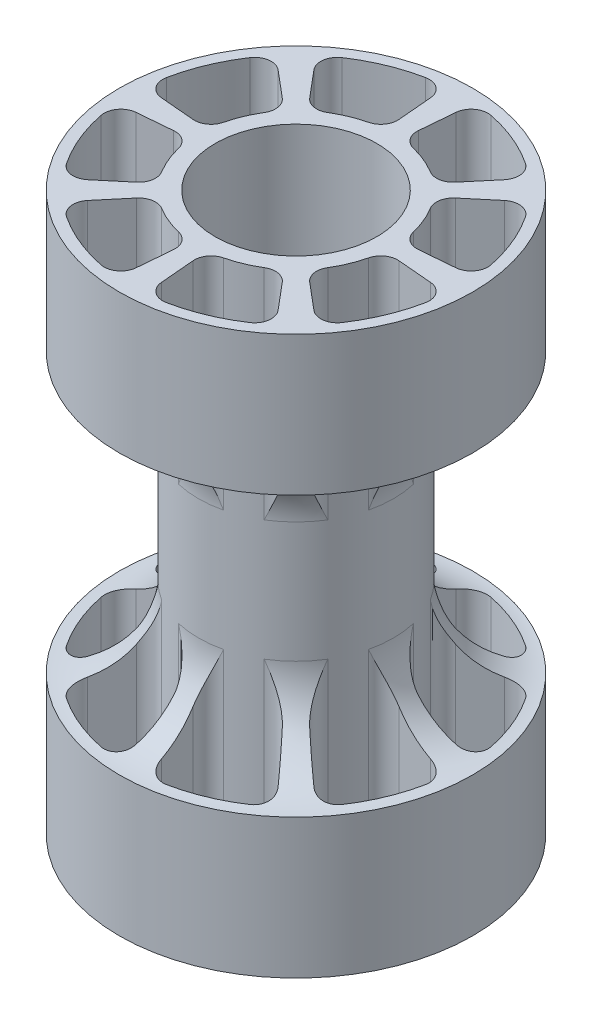
from build123d import *
from build123d.topology import SkipClean

# Parameters (mm, degrees)
SKETCH1_R           = 17.5
SKETCH1_R_2         = 14.5
BOSS_EXTRUDE1_DEPTH = 100
SKETCH2_R           = 31.685
BOSS_EXTRUDE2_DEPTH = 100
FILLET1_R           = 3


with BuildPart() as part:
    # Sketch1 → Boss-Extrude1 (new body)
    with BuildSketch(Plane(origin=(0, 0, 0), x_dir=(1, 0, 0), z_dir=(0, 1, 0))):
        with Locations(Location((0, 0, 0), (0, 0, 270))):
            Circle(SKETCH1_R)
        with Locations(Location((0, 0, 0), (0, 0, 270))):
            Circle(SKETCH1_R_2, mode=Mode.SUBTRACT)
    extrude(amount=BOSS_EXTRUDE1_DEPTH)

    # Sketch2 → Boss-Extrude2 (add)
    with BuildSketch(Plane.XZ):
        with Locations(Location((0, 0, 0), (0, 0, 270))):
            Circle(SKETCH2_R)
        with BuildLine():
            Line((-1.5, 17.435595774), (-2.272785403, 26.41824505))
            ThreePointArc((-2.272785403, 26.41824505), (-3.462351882, 28.561557475), (-5.853284272, 29.102204182))
            ThreePointArc((-5.853284272, 29.102204182), (-11.35995769, 27.425363923), (-16.439468924, 24.717262925))
            ThreePointArc((-16.439468924, 24.717262925), (-17.747818477, 22.644323466), (-17.073418251, 20.287622193))
            Line((-17.073418251, 20.287622193), (-11.268167834, 13.389488178))
            ThreePointArc((-11.268167834, 13.389488178), (-12.374368671, 12.374368671), (-13.389488178, 11.268167834))
            Line((-13.389488178, 11.268167834), (-20.287622193, 17.073418251))
            ThreePointArc((-20.287622193, 17.073418251), (-22.644323466, 17.747818477), (-24.717262925, 16.439468924))
            ThreePointArc((-24.717262925, 16.439468924), (-27.425363923, 11.35995769), (-29.102204182, 5.853284272))
            ThreePointArc((-29.102204182, 5.853284272), (-28.561557475, 3.462351882), (-26.41824505, 2.272785403))
            Line((-26.41824505, 2.272785403), (-17.435595774, 1.5))
            ThreePointArc((-17.435595774, 1.5), (-17.5, 0), (-17.435595774, -1.5))
            Line((-17.435595774, -1.5), (-26.41824505, -2.272785403))
            ThreePointArc((-26.41824505, -2.272785403), (-28.561557475, -3.462351882), (-29.102204182, -5.853284272))
            ThreePointArc((-29.102204182, -5.853284272), (-27.425363923, -11.35995769), (-24.717262925, -16.439468924))
            ThreePointArc((-24.717262925, -16.439468924), (-22.644323466, -17.747818477), (-20.287622193, -17.073418251))
            Line((-20.287622193, -17.073418251), (-13.389488178, -11.268167834))
            ThreePointArc((-13.389488178, -11.268167834), (-12.374368671, -12.374368671), (-11.268167834, -13.389488178))
            Line((-11.268167834, -13.389488178), (-17.073418251, -20.287622193))
            ThreePointArc((-17.073418251, -20.287622193), (-17.747818477, -22.644323466), (-16.439468924, -24.717262925))
            ThreePointArc((-16.439468924, -24.717262925), (-11.35995769, -27.425363923), (-5.853284272, -29.102204182))
            ThreePointArc((-5.853284272, -29.102204182), (-3.462351882, -28.561557475), (-2.272785403, -26.41824505))
            Line((-2.272785403, -26.41824505), (-1.5, -17.435595774))
            ThreePointArc((-1.5, -17.435595774), (0, -17.5), (1.5, -17.435595774))
            Line((1.5, -17.435595774), (2.272785403, -26.41824505))
            ThreePointArc((2.272785403, -26.41824505), (3.462351882, -28.561557475), (5.853284272, -29.102204182))
            ThreePointArc((5.853284272, -29.102204182), (11.35995769, -27.425363923), (16.439468924, -24.717262925))
            ThreePointArc((16.439468924, -24.717262925), (17.747818477, -22.644323466), (17.073418251, -20.287622193))
            Line((17.073418251, -20.287622193), (11.268167834, -13.389488178))
            ThreePointArc((11.268167834, -13.389488178), (12.374368671, -12.374368671), (13.389488178, -11.268167834))
            Line((13.389488178, -11.268167834), (20.287622193, -17.073418251))
            ThreePointArc((20.287622193, -17.073418251), (22.644323466, -17.747818477), (24.717262925, -16.439468924))
            ThreePointArc((24.717262925, -16.439468924), (27.425363923, -11.35995769), (29.102204182, -5.853284272))
            ThreePointArc((29.102204182, -5.853284272), (28.561557475, -3.462351882), (26.41824505, -2.272785403))
            Line((26.41824505, -2.272785403), (17.435595774, -1.5))
            ThreePointArc((17.435595774, -1.5), (17.5, 0), (17.435595774, 1.5))
            Line((17.435595774, 1.5), (26.41824505, 2.272785403))
            ThreePointArc((26.41824505, 2.272785403), (28.561557475, 3.462351882), (29.102204182, 5.853284272))
            ThreePointArc((29.102204182, 5.853284272), (27.425363923, 11.35995769), (24.717262925, 16.439468924))
            ThreePointArc((24.717262925, 16.439468924), (22.644323466, 17.747818477), (20.287622193, 17.073418251))
            Line((20.287622193, 17.073418251), (13.389488178, 11.268167834))
            ThreePointArc((13.389488178, 11.268167834), (12.374368671, 12.374368671), (11.268167834, 13.389488178))
            Line((11.268167834, 13.389488178), (17.073418251, 20.287622193))
            ThreePointArc((17.073418251, 20.287622193), (17.747818477, 22.644323466), (16.439468924, 24.717262925))
            ThreePointArc((16.439468924, 24.717262925), (11.35995769, 27.425363923), (5.853284272, 29.102204182))
            ThreePointArc((5.853284272, 29.102204182), (3.462351882, 28.561557475), (2.272785403, 26.41824505))
            Line((2.272785403, 26.41824505), (1.5, 17.435595774))
            ThreePointArc((1.5, 17.435595774), (0, 17.5), (-1.5, 17.435595774))
        make_face(mode=Mode.SUBTRACT)
    extrude(amount=-BOSS_EXTRUDE2_DEPTH)

    # Fillet1
    fillet1_edges = [part.edges().sort_by_distance(p)[0] for p in [
        (17.435595774, 50, 1.5),
        (17.435595774, 50, -1.5),
        (13.389488178, 50, -11.268167834),
        (11.268167834, 50, -13.389488178),
        (1.5, 50, -17.435595774),
        (-1.5, 50, -17.435595774),
        (-11.268167834, 50, -13.389488178),
        (-13.389488178, 50, -11.268167834),
        (-17.435595774, 50, -1.5),
        (-17.435595774, 50, 1.5),
        (-13.389488178, 50, 11.268167834),
        (-11.268167834, 50, 13.389488178),
        (-1.5, 50, 17.435595774),
        (1.5, 50, 17.435595774),
        (11.268167834, 50, 13.389488178),
        (13.389488178, 50, 11.268167834),
    ]]
    fillet(fillet1_edges, radius=FILLET1_R)

    # Sketch7 → Cut-Revolve2 (revolve, cut)
    with SkipClean():  # the faces are left unmerged after this step: merging them gives an invalid solid
        with BuildSketch(Plane(origin=(0, 0, 0), x_dir=(0, 0, -1), z_dir=(1, 0, 0)), mode=Mode.PRIVATE) as cut_revolve2_sk:
            with BuildLine():
                Line((-31.685, 75), (-31.685, 25))
                ThreePointArc((-31.685, 25), (-21.654690309, 29.154690309), (-17.5, 39.185))
                Line((-17.5, 39.185), (-17.5, 60.815))
                ThreePointArc((-17.5, 60.815), (-21.654690309, 70.845309691), (-31.685, 75))
            make_face()
        revolve(cut_revolve2_sk.sketch.rotate(Axis((0, 0, 0), (0, 1, 0)), 180), axis=Axis((0, 0, 0), (0, 1, 0)), mode=Mode.SUBTRACT)


solid = part.part
